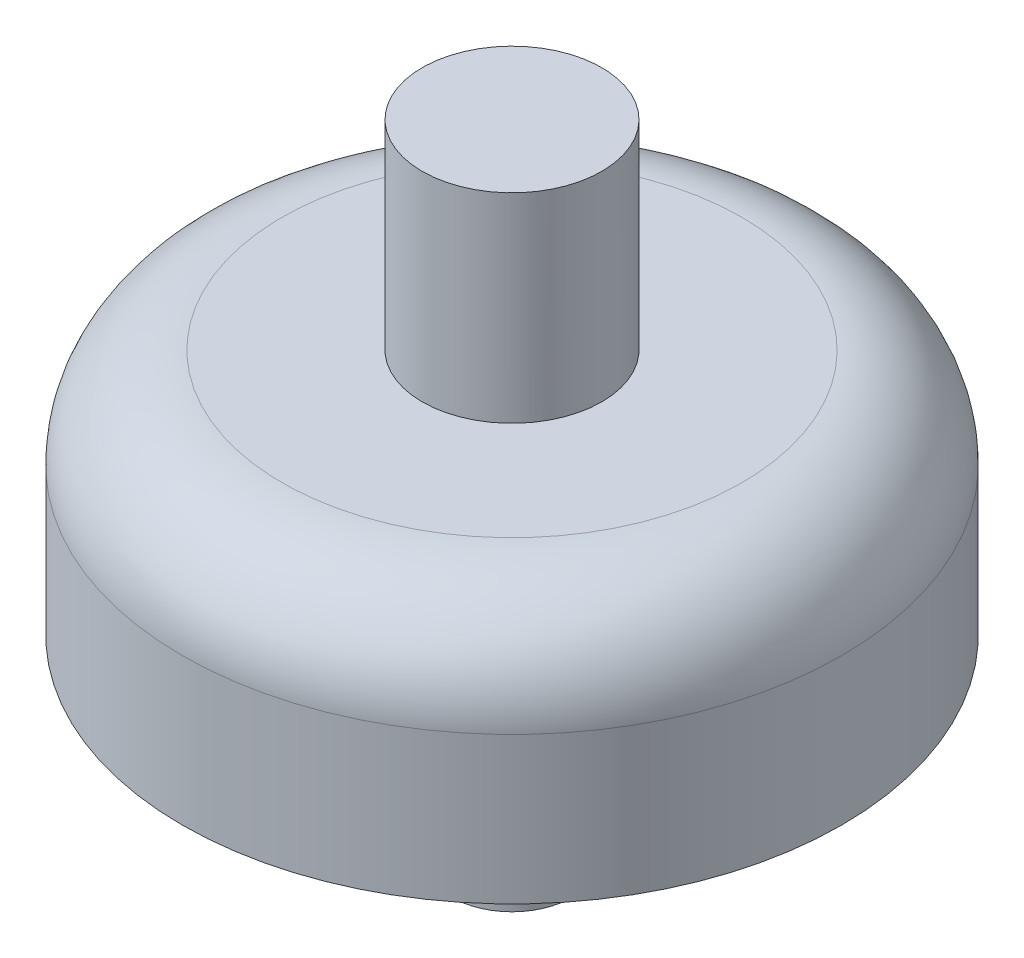
from build123d import *

# Parameters (mm, degrees)
SKETCH1_W                = 16.518614554
SKETCH1_H                = 12.353050884
BOSS_EXTRUDE1_DEPTH      = 10
BOSS_EXTRUDE1_DEPTH_BACK = 18
SKETCH3_R                = 4.5
FILLET1_R                = 5
SKETCH4_R                = 9.759449404
SKETCH4_R_2              = 3
BOSS_EXTRUDE2_DEPTH      = 3
SCALE2_SCALE             = 1.5
SCALE3_SCALE             = 0.7


with BuildPart() as part:
    # Sketch1 → Revolve1 (revolve)
    with BuildSketch(Plane.XY, mode=Mode.PRIVATE) as revolve1_sk:
        with Locations((8.259307277, 6.176525442)):
            Rectangle(SKETCH1_W, SKETCH1_H)
    revolve(revolve1_sk.sketch.rotate(Axis((16.518614554, 0, 0), (0, 1, 0)), 270), axis=Axis((16.518614554, 0, 0), (0, 1, 0)))

    # Sketch3 → Boss-Extrude1 (add, two sides: drawn at the far end of the back side and taken through both)
    with BuildSketch(Plane(origin=(0, 12.353050884, 0), x_dir=(1, 0, 0), z_dir=(0, 1, 0)).offset(-BOSS_EXTRUDE1_DEPTH_BACK)):
        with Locations(Location((16.518614554, 0, 0), (0, 0, 270))):
            Circle(SKETCH3_R)
    extrude(amount=BOSS_EXTRUDE1_DEPTH + BOSS_EXTRUDE1_DEPTH_BACK)

    # Fillet1
    fillet1_edges = [part.edges().sort_by_distance(p)[0] for p in [
        (16.518614554, 12.353050884, 16.518614554),
    ]]
    fillet(fillet1_edges, radius=FILLET1_R)

    # Sketch4 → Boss-Extrude2 (add)
    with BuildSketch(Plane.XZ):
        with BuildLine():
            Line((11.738962044, -4.77965251), (16.518614554, 0))
            Line((16.518614554, 0), (11.881429434, 4.637185121))
            ThreePointArc((11.881429434, 4.637185121), (9.893846238, 3.761487884), (7.836164974, 4.456671622))
            ThreePointArc((7.836164974, 4.456671622), (6.759173098, -0.012454385), (7.847567883, -4.478817062))
            ThreePointArc((7.847567883, -4.478817062), (9.848875397, -3.909897633), (11.738962044, -4.77965251))
        make_face()
        with BuildLine():
            Line((21.298267065, 4.77965251), (16.518614554, 0))
            Line((16.518614554, 0), (21.298267065, -4.77965251))
            ThreePointArc((21.298267065, -4.77965251), (23.188353712, -3.909897633), (25.189661226, -4.478817062))
            ThreePointArc((25.189661226, -4.478817062), (26.002060498, -2.304583627), (26.278063958, 0))
            ThreePointArc((26.278063958, 0), (26.002060498, 2.304583627), (25.189661226, 4.478817062))
            ThreePointArc((25.189661226, 4.478817062), (23.188353712, 3.909897633), (21.298267065, 4.77965251))
        make_face()
        with BuildLine():
            Line((11.881429434, 4.637185121), (16.518614554, 0))
            Line((16.518614554, 0), (21.298267065, 4.77965251))
            ThreePointArc((21.298267065, 4.77965251), (20.428512187, 6.669739158), (20.997431617, 8.671046672))
            ThreePointArc((20.997431617, 8.671046672), (16.53106894, 9.759441457), (12.061942933, 8.68244958))
            ThreePointArc((12.061942933, 8.68244958), (12.580171282, 7.781857425), (12.76010909, 6.758505464))
            ThreePointArc((12.76010909, 6.758505464), (12.531747688, 5.610455167), (11.881429434, 4.637185121))
        make_face()
        with BuildLine():
            Line((21.298267065, -4.77965251), (16.518614554, 0))
            Line((16.518614554, 0), (11.738962044, -4.77965251))
            ThreePointArc((11.738962044, -4.77965251), (12.389280298, -5.752922557), (12.6176417, -6.900972854))
            ThreePointArc((12.6176417, -6.900972854), (12.469524182, -7.831975707), (12.039797492, -8.671046672))
            ThreePointArc((12.039797492, -8.671046672), (16.518614554, -9.759449404), (20.997431617, -8.671046672))
            ThreePointArc((20.997431617, -8.671046672), (20.428512187, -6.669739158), (21.298267065, -4.77965251))
        make_face()
        with Locations((16.518614554, 0)):
            Circle(SKETCH4_R)
        with Locations((9.6176417, -6.900972854)):
            Circle(SKETCH4_R_2)
        with BuildLine():
            ThreePointArc((12.6176417, -6.900972854), (12.389280298, -5.752922557), (11.738962044, -4.77965251))
            Line((11.738962044, -4.77965251), (9.6176417, -6.900972854))
            ThreePointArc((9.6176417, -6.900972854), (10.760299266, -7.879635632), (12.039797492, -8.671046672))
            ThreePointArc((12.039797492, -8.671046672), (12.469524182, -7.831975707), (12.6176417, -6.900972854))
        make_face()
        with BuildLine():
            Line((9.6176417, -6.900972854), (11.738962044, -4.77965251))
            ThreePointArc((11.738962044, -4.77965251), (9.848875397, -3.909897633), (7.847567883, -4.478817062))
            ThreePointArc((7.847567883, -4.478817062), (8.638978922, -5.758315289), (9.6176417, -6.900972854))
        make_face()
        with Locations((9.76010909, 6.758505464)):
            Circle(SKETCH4_R_2)
        with BuildLine():
            Line((11.881429434, 4.637185121), (13.336634039, 3.181980515))
            ThreePointArc((13.336634039, 3.181980515), (16.518614554, 4.5), (19.70059507, 3.181980515))
            Line((19.70059507, 3.181980515), (21.298267065, 4.77965251))
            ThreePointArc((21.298267065, 4.77965251), (20.428512187, 6.669739158), (20.997431617, 8.671046672))
            ThreePointArc((20.997431617, 8.671046672), (16.53106894, 9.759441457), (12.061942933, 8.68244958))
            ThreePointArc((12.061942933, 8.68244958), (12.580171282, 7.781857425), (12.76010909, 6.758505464))
            ThreePointArc((12.76010909, 6.758505464), (12.531747688, 5.610455167), (11.881429434, 4.637185121))
        make_face()
        with Locations((23.419587408, 6.900972854)):
            Circle(SKETCH4_R_2)
        with BuildLine():
            Line((23.419587408, 6.900972854), (21.298267065, 4.77965251))
            ThreePointArc((21.298267065, 4.77965251), (23.188353712, 3.909897633), (25.189661226, 4.478817062))
            ThreePointArc((25.189661226, 4.478817062), (24.398250187, 5.758315289), (23.419587408, 6.900972854))
        make_face()
        with BuildLine():
            ThreePointArc((20.997431617, 8.671046672), (20.428512187, 6.669739158), (21.298267065, 4.77965251))
            Line((21.298267065, 4.77965251), (23.419587408, 6.900972854))
            ThreePointArc((23.419587408, 6.900972854), (22.276929843, 7.879635632), (20.997431617, 8.671046672))
        make_face()
        with Locations((23.419587408, -6.900972854)):
            Circle(SKETCH4_R_2)
        with BuildLine():
            Line((23.419587408, -6.900972854), (21.298267065, -4.77965251))
            ThreePointArc((21.298267065, -4.77965251), (20.428512187, -6.669739158), (20.997431617, -8.671046672))
            ThreePointArc((20.997431617, -8.671046672), (22.276929843, -7.879635632), (23.419587408, -6.900972854))
        make_face()
        with BuildLine():
            ThreePointArc((25.189661226, -4.478817062), (23.188353712, -3.909897633), (21.298267065, -4.77965251))
            Line((21.298267065, -4.77965251), (23.419587408, -6.900972854))
            ThreePointArc((23.419587408, -6.900972854), (24.398250187, -5.758315289), (25.189661226, -4.478817062))
        make_face()
    extrude(amount=BOSS_EXTRUDE2_DEPTH)


with BuildPart() as part_1:
    # Scale2: scaled about (16.521177645, 5.714728263, -0.002563091)
    add(part.part.scale(SCALE2_SCALE).moved(Location((-8.260588823, -2.857364131, 0.001281545))))


with BuildPart() as part_2:
    # Scale3: scaled about (16.521177645, 5.714728263, -0.002563091)
    add(part_1.part.scale(SCALE3_SCALE).moved(Location((4.956353294, 1.714418479, -0.000768927))))


solid = part_2.part
